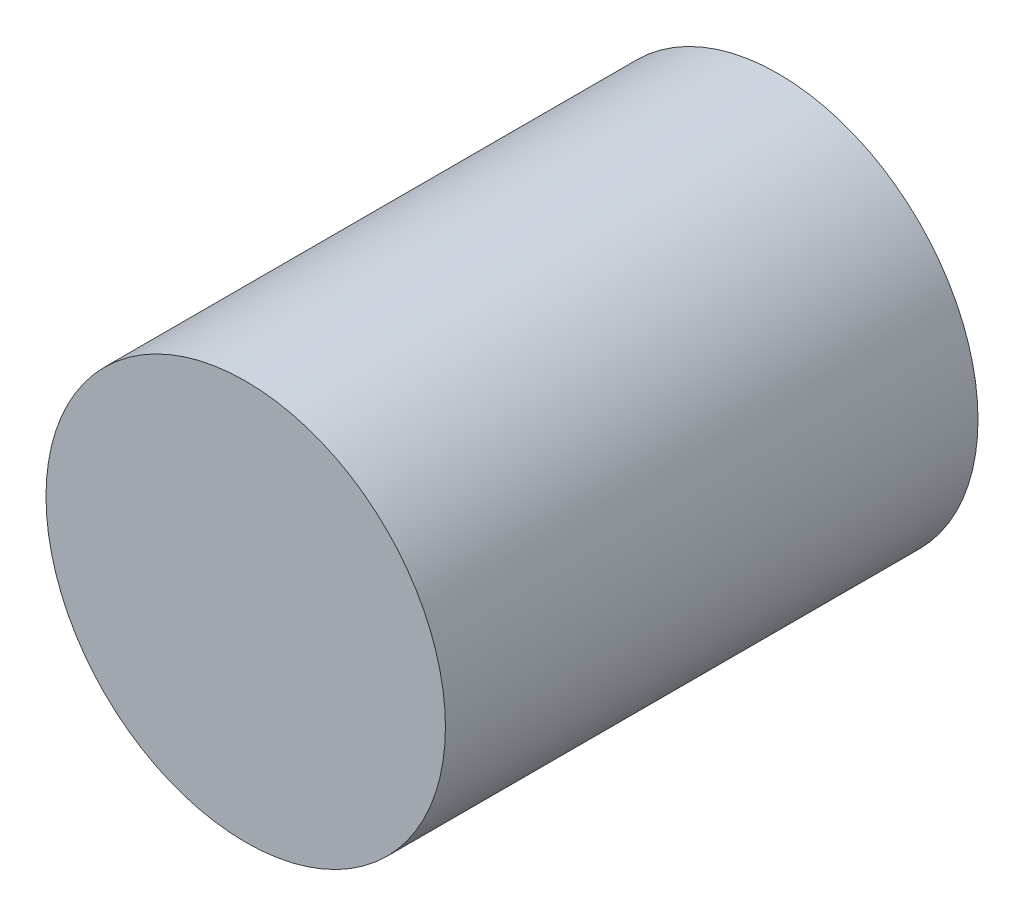
from build123d import *

# Parameters (mm, degrees)
SKETCH2_R           = 7.5
BOSS_EXTRUDE2_DEPTH = 20


with BuildPart() as part:
    # Sketch2 → Boss-Extrude2 (new body)
    with BuildSketch(Plane.XY):
        Circle(SKETCH2_R)
    extrude(amount=BOSS_EXTRUDE2_DEPTH)


solid = part.part
